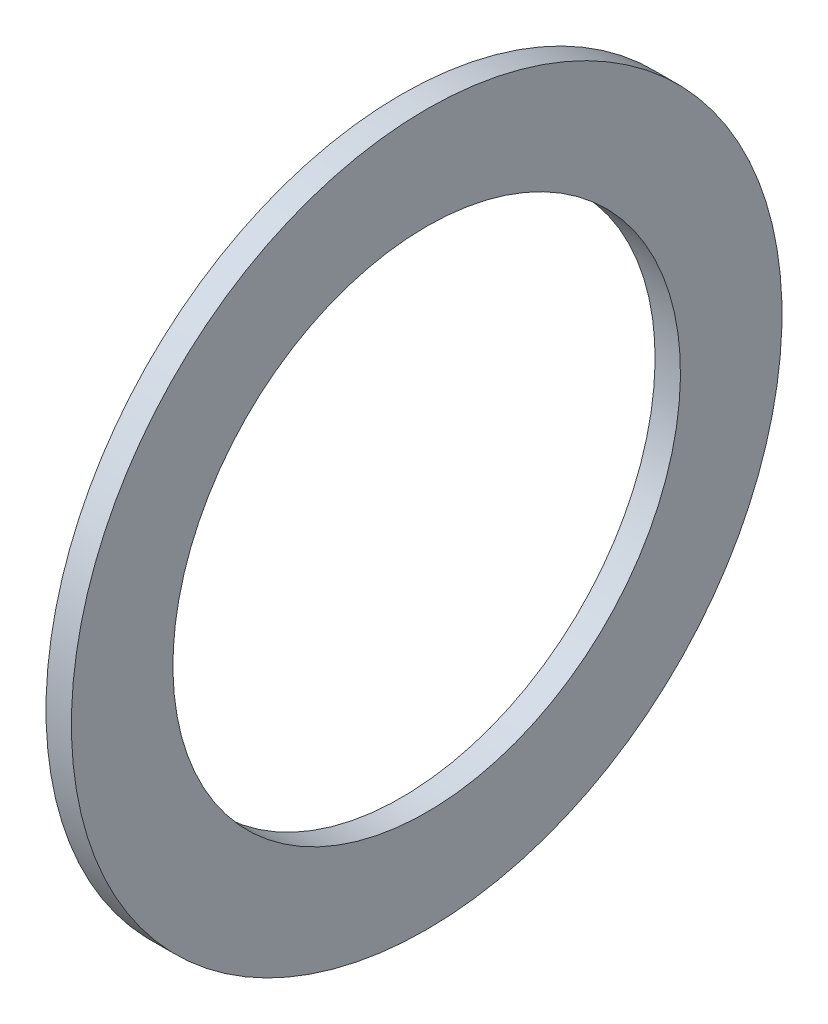
from build123d import *

# Parameters (mm, degrees)
SKETCH1_W      = 50
SKETCH1_H      = 200
REVOLVE1_ANGLE = 359.999999589


with BuildPart() as part:
    # Sketch1 → Revolve1 (revolve)
    with BuildSketch(Plane.XY):
        with Locations((1475, 600)):
            Rectangle(SKETCH1_W, SKETCH1_H)
    revolve(axis=Axis((0, 0, 0), (1, 0, 0)), revolution_arc=REVOLVE1_ANGLE)


solid = part.part
